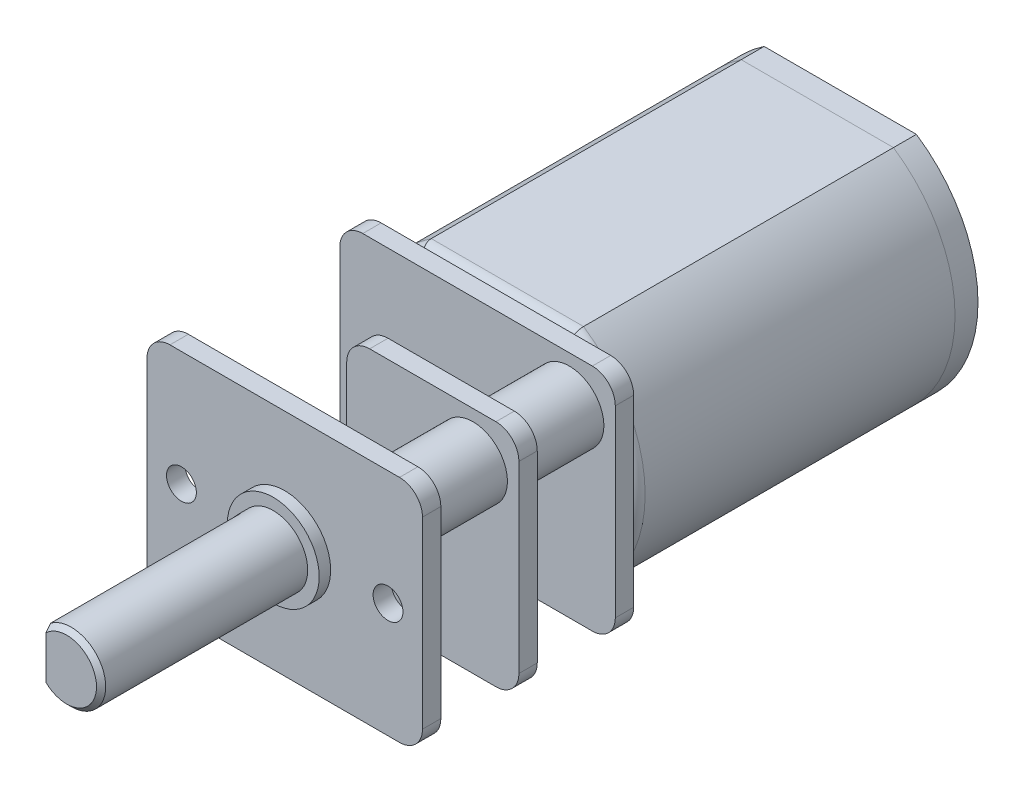
from build123d import *

# Parameters (mm, degrees)
BOSS_EXTRUDE1_DEPTH   = 14
BOSS_EXTRUDE2_DEPTH   = 1
SKETCH3_R             = 2.5
BOSS_EXTRUDE3_DEPTH   = 1
FILLET1_R             = 0.5
SKETCH4_W             = 0.3
SKETCH4_H             = 1.5
BOSS_EXTRUDE4_DEPTH   = 1.5
BOSS_EXTRUDE4_2_DEPTH = 1.5
SKETCH5_R             = 1
CUT_EXTRUDE1_DEPTH    = 1
BOSS_EXTRUDE5_DEPTH   = 0.8
LPATTERN1_COUNT       = 2
LPATTERN1_PITCH       = 4.2
LPATTERN2_COUNT       = 2
LPATTERN2_PITCH       = 8.4
BOSS_EXTRUDE6_REACH   = 20.981
SKETCH7_R             = 1.5
SKETCH8_R             = 2
BOSS_EXTRUDE7_DEPTH   = 0.5
SKETCH9_R             = 1.5
BOSS_EXTRUDE8_DEPTH   = 9
SKETCH10_W            = 0.6
SKETCH10_H            = 2.4
CUT_EXTRUDE2_DEPTH    = 8.5
CHAMFER1_SIZE         = 0.2
SKETCH11_R            = 0.65
CUT_EXTRUDE3_DEPTH    = 0.8
SKETCH12_W            = 4.5
SKETCH12_H            = 5
CUT_EXTRUDE4_DEPTH    = 0.8
FILLET2_R             = 1


with BuildPart() as part:
    # Sketch1 → Boss-Extrude1 (new body)
    with BuildSketch(Plane.XY):
        with BuildLine():
            Line((-3.31662479, 5), (3.31662479, 5))
            ThreePointArc((3.31662479, 5), (6, 0), (3.31662479, -5))
            Line((3.31662479, -5), (-3.31662479, -5))
            ThreePointArc((-3.31662479, -5), (-6, 0), (-3.31662479, 5))
        make_face()
    extrude(amount=-BOSS_EXTRUDE1_DEPTH)

    # Fillet1
    fillet1_edges = [part.edges().sort_by_distance(p)[0] for p in [
        (0, 5, 0),
        (6, 0, 0),
        (0, -5, 0),
        (-6, 0, 0),
    ]]
    fillet(fillet1_edges, radius=FILLET1_R)


with BuildPart() as body_2:
    # Sketch2 → Boss-Extrude2 (new body)
    with BuildSketch(Plane(origin=(0, 0, -14), x_dir=(-1, 0, 0), z_dir=(0, 0, -1))):
        with BuildLine():
            Line((3.31662479, 5), (-3.31662479, 5))
            ThreePointArc((-3.31662479, 5), (-6, 0), (-3.31662479, -5))
            Line((-3.31662479, -5), (3.31662479, -5))
            ThreePointArc((3.31662479, -5), (6, 0), (3.31662479, 5))
        make_face()
    extrude(amount=BOSS_EXTRUDE2_DEPTH)

    # Sketch3 → Boss-Extrude3 (add)
    with BuildSketch(Plane(origin=(0, 0, -15), x_dir=(-1, 0, 0), z_dir=(0, 0, -1))):
        Circle(SKETCH3_R)
    extrude(amount=BOSS_EXTRUDE3_DEPTH)

    # Sketch5 → Cut-Extrude1 (cut)
    with BuildSketch(Plane(origin=(0, 0, -16), x_dir=(-1, 0, 0), z_dir=(0, 0, -1))):
        Circle(SKETCH5_R)
    extrude(amount=-CUT_EXTRUDE1_DEPTH, mode=Mode.SUBTRACT)


with BuildPart() as body_3:
    # Sketch4 → Boss-Extrude4 (new body)
    with BuildSketch(Plane(origin=(0, 0, -15), x_dir=(-1, 0, 0), z_dir=(0, 0, -1))):
        with Locations((-3.65, 0)):
            Rectangle(SKETCH4_W, SKETCH4_H)
    extrude(amount=BOSS_EXTRUDE4_DEPTH)


with BuildPart() as body_4:
    # Sketch4 → Boss-Extrude4 2 (new body)
    with BuildSketch(Plane(origin=(0, 0, -15), x_dir=(-1, 0, 0), z_dir=(0, 0, -1))):
        with Locations((3.65, 0)):
            Rectangle(SKETCH4_W, SKETCH4_H)
    extrude(amount=BOSS_EXTRUDE4_2_DEPTH)


with BuildPart() as body_5:
    # Sketch6 → Boss-Extrude5 (new body)
    with BuildSketch(Plane.XY):
        with BuildLine():
            Line((-5, 5), (5, 5))
            ThreePointArc((5, 5), (5.707106781, 4.707106781), (6, 4))
            Line((6, 4), (6, -4))
            ThreePointArc((6, -4), (5.707106781, -4.707106781), (5, -5))
            Line((5, -5), (-5, -5))
            ThreePointArc((-5, -5), (-5.707106781, -4.707106781), (-6, -4))
            Line((-6, -4), (-6, 4))
            ThreePointArc((-6, 4), (-5.707106781, 4.707106781), (-5, 5))
        make_face()
    boss_extrude5 = extrude(amount=BOSS_EXTRUDE5_DEPTH)


with BuildPart() as lpattern1_1:
    # LPattern1: Boss-Extrude5 ×2
    with Locations(*[(0, 0, i * LPATTERN1_PITCH) for i in range(1, LPATTERN1_COUNT)]):
        add(boss_extrude5)


with BuildPart() as lpattern2_1:
    # LPattern2: Boss-Extrude5 ×2
    with Locations(*[(0, 0, i * LPATTERN2_PITCH) for i in range(1, LPATTERN2_COUNT)]):
        add(boss_extrude5)

    # Boss-Extrude6: up to this face of the body (flat: up to its plane)
    boss_extrude6_end = Plane(lpattern2_1.part.faces().sort_by_distance((0, 0, 9.2))[0])
    # Sketch7 → Boss-Extrude6 (add, up to the picked face)
    with BuildSketch(Plane.XY.offset(0.8), mode=Mode.PRIVATE) as boss_extrude6_sk1:
        with Locations(Location((4, 3, 0), (0, 0, 180))):
            Circle(SKETCH7_R)
    boss_extrude6_tool1 = split(extrude(boss_extrude6_sk1.sketch, amount=BOSS_EXTRUDE6_REACH, mode=Mode.PRIVATE), bisect_by=boss_extrude6_end, keep=Keep.BOTH, mode=Mode.PRIVATE)
    # Sketch7 → Boss-Extrude6 (add, up to the picked face)
    with BuildSketch(Plane.XY.offset(0.8), mode=Mode.PRIVATE) as boss_extrude6_sk2:
        with Locations(Location((-4, -3, 0), (0, 0, 180))):
            Circle(SKETCH7_R)
    boss_extrude6_tool2 = split(extrude(boss_extrude6_sk2.sketch, amount=BOSS_EXTRUDE6_REACH, mode=Mode.PRIVATE), bisect_by=boss_extrude6_end, keep=Keep.BOTH, mode=Mode.PRIVATE)

    add(body_5.part)  # Boss-Extrude6 merges body 5

    add(lpattern1_1.part)  # Boss-Extrude6 merges LPattern1_1
    add(boss_extrude6_tool1.solids().sort_by(Axis((4, 3, 0.8), (0, 0, 1)))[0])
    add(boss_extrude6_tool2.solids().sort_by(Axis((-4, -3, 0.8), (0, 0, 1)))[0])

    # Sketch8 → Boss-Extrude7 (add)
    with BuildSketch(Plane.XY.offset(9.2)):
        with Locations(Location((0, 0, 0), (0, 0, 180))):
            Circle(SKETCH8_R)
    extrude(amount=BOSS_EXTRUDE7_DEPTH)

    # Sketch11 → Cut-Extrude3 (cut)
    with BuildSketch(Plane.XY.offset(9.2)):
        with Locations((-4.5, 0)):
            Circle(SKETCH11_R)
        with Locations((4.5, 0)):
            Circle(SKETCH11_R)
    extrude(amount=-CUT_EXTRUDE3_DEPTH, mode=Mode.SUBTRACT)

    # Sketch12 → Cut-Extrude4 (cut)
    with BuildSketch(Plane.XY.offset(5)):
        with Locations((-3.75, 2.5)):
            Rectangle(SKETCH12_W, SKETCH12_H)
    extrude(amount=-CUT_EXTRUDE4_DEPTH, mode=Mode.SUBTRACT)

    # Fillet2
    fillet2_edges = [lpattern2_1.edges().sort_by_distance(p)[0] for p in [
        (-1.5, 0, 4.6),
        (-1.5, 5, 4.6),
        (-6, 0, 4.6),
    ]]
    fillet(fillet2_edges, radius=FILLET2_R)


with BuildPart() as body_6:
    # Sketch9 → Boss-Extrude8 (new body)
    with BuildSketch(Plane.XY.offset(9.7)):
        Circle(SKETCH9_R)
    extrude(amount=BOSS_EXTRUDE8_DEPTH)

    # Sketch10 → Cut-Extrude2 (cut)
    with BuildSketch(Plane.XY.offset(18.7)):
        with Locations((-1.2, 0)):
            Rectangle(SKETCH10_W, SKETCH10_H)
    extrude(amount=-CUT_EXTRUDE2_DEPTH, mode=Mode.SUBTRACT)

    # Chamfer1
    chamfer1_edges = [body_6.edges().sort_by_distance(p)[0] for p in [
        (0.670820393, 1.341640786, 18.7),
    ]]
    chamfer(chamfer1_edges, length=CHAMFER1_SIZE)


solid = Compound([part.part, body_2.part, body_3.part, body_4.part, lpattern2_1.part, body_6.part])
